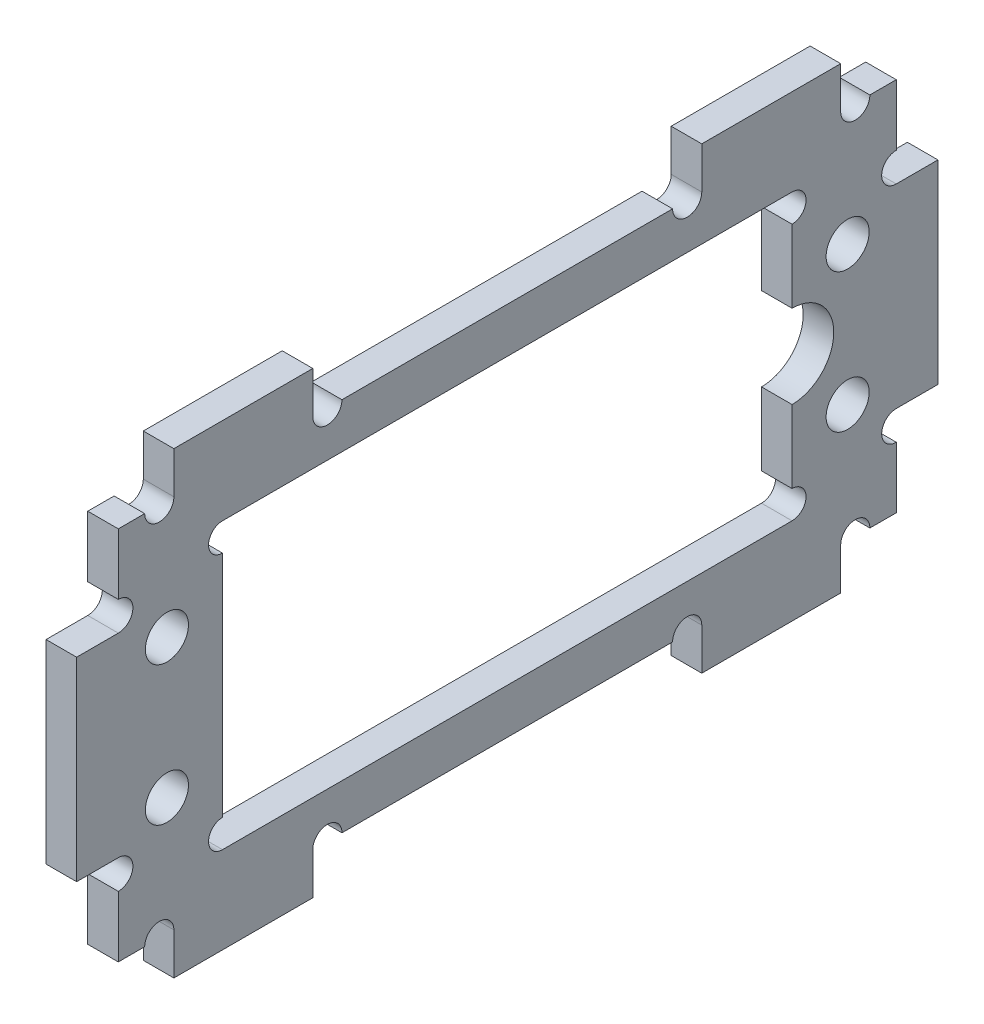
from build123d import *

# Parameters (mm, degrees)
SKETCH_1_R      = 1.55
EXTRUDE_1_DEPTH = 2.2


with BuildPart() as part:
    # 草图1 → 凸台-拉伸1 (new body)
    with BuildSketch(Plane(origin=(0, 0, 0), x_dir=(0, 0, -1), z_dir=(1, 0, 0))):
        with BuildLine():
            Line((-24, 16.5), (-24, 13.5))
            ThreePointArc((-24, 13.5), (-25.05, 12.45), (-26.1, 13.5))
            Line((-26.1, 13.5), (-28, 13.5))
            Line((-28, 13.5), (-28, 9.1))
            ThreePointArc((-28, 9.1), (-27.25753788, 8.79246212), (-26.95, 8.05))
            ThreePointArc((-26.95, 8.05), (-27.25753788, 7.30753788), (-28, 7))
            Line((-28, 7), (-31, 7))
            Line((-31, 7), (-31, -7))
            Line((-31, -7), (-28, -7))
            ThreePointArc((-28, -7), (-27.25753788, -7.30753788), (-26.95, -8.05))
            ThreePointArc((-26.95, -8.05), (-27.25753788, -8.79246212), (-28, -9.1))
            Line((-28, -9.1), (-28, -13.5))
            Line((-28, -13.5), (-26.1, -13.5))
            ThreePointArc((-26.1, -13.5), (-25.05, -12.45), (-24, -13.5))
            Line((-24, -13.5), (-24, -16.5))
            Line((-24, -16.5), (-14, -16.5))
            Line((-14, -16.5), (-14, -13.5))
            ThreePointArc((-14, -13.5), (-12.95, -12.45), (-11.9, -13.5))
            Line((-11.9, -13.5), (11.9, -13.5))
            ThreePointArc((11.9, -13.5), (12.95, -12.45), (14, -13.5))
            Line((14, -13.5), (14, -16.5))
            Line((14, -16.5), (24, -16.5))
            Line((24, -16.5), (24, -13.5))
            ThreePointArc((24, -13.5), (25.05, -12.45), (26.1, -13.5))
            Line((26.1, -13.5), (28, -13.5))
            Line((28, -13.5), (28, -9.1))
            ThreePointArc((28, -9.1), (26.95, -8.05), (28, -7))
            Line((28, -7), (31, -7))
            Line((31, -7), (31, 7))
            Line((31, 7), (28, 7))
            ThreePointArc((28, 7), (26.95, 8.05), (28, 9.1))
            Line((28, 9.1), (28, 13.5))
            Line((28, 13.5), (26.1, 13.5))
            ThreePointArc((26.1, 13.5), (25.05, 12.45), (24, 13.5))
            Line((24, 13.5), (24, 16.5))
            Line((24, 16.5), (14, 16.5))
            Line((14, 16.5), (14, 13.5))
            ThreePointArc((14, 13.5), (12.95, 12.45), (11.9, 13.5))
            Line((11.9, 13.5), (-11.9, 13.5))
            ThreePointArc((-11.9, 13.5), (-12.95, 12.45), (-14, 13.5))
            Line((-14, 13.5), (-14, 16.5))
            Line((-14, 16.5), (-24, 16.5))
        make_face()
        with Locations((-24.5, -5)):
            Circle(SKETCH_1_R, mode=Mode.SUBTRACT)
        with BuildLine():
            Line((20.5, 8.24), (20.5, 3))
            ThreePointArc((20.5, 3), (23.5, 0), (20.5, -3))
            Line((20.5, -3), (20.5, -8.24))
            ThreePointArc((20.5, -8.24), (21.210642315, -8.534357685), (21.505, -9.245))
            ThreePointArc((21.505, -9.245), (21.210642315, -9.955642315), (20.5, -10.25))
            Line((20.5, -10.25), (-20.5, -10.25))
            ThreePointArc((-20.5, -10.25), (-21.505, -9.245), (-20.5, -8.24))
            Line((-20.5, -8.24), (-20.5, 8.24))
            ThreePointArc((-20.5, 8.24), (-21.505, 9.245), (-20.5, 10.25))
            Line((-20.5, 10.25), (20.5, 10.25))
            ThreePointArc((20.5, 10.25), (21.210642315, 9.955642315), (21.505, 9.245))
            ThreePointArc((21.505, 9.245), (21.210642315, 8.534357685), (20.5, 8.24))
        make_face(mode=Mode.SUBTRACT)
        with Locations((24.5, -5)):
            Circle(SKETCH_1_R, mode=Mode.SUBTRACT)
        with Locations((-24.5, 5)):
            Circle(SKETCH_1_R, mode=Mode.SUBTRACT)
        with Locations((24.5, 5)):
            Circle(SKETCH_1_R, mode=Mode.SUBTRACT)
    extrude(amount=EXTRUDE_1_DEPTH)


solid = part.part
